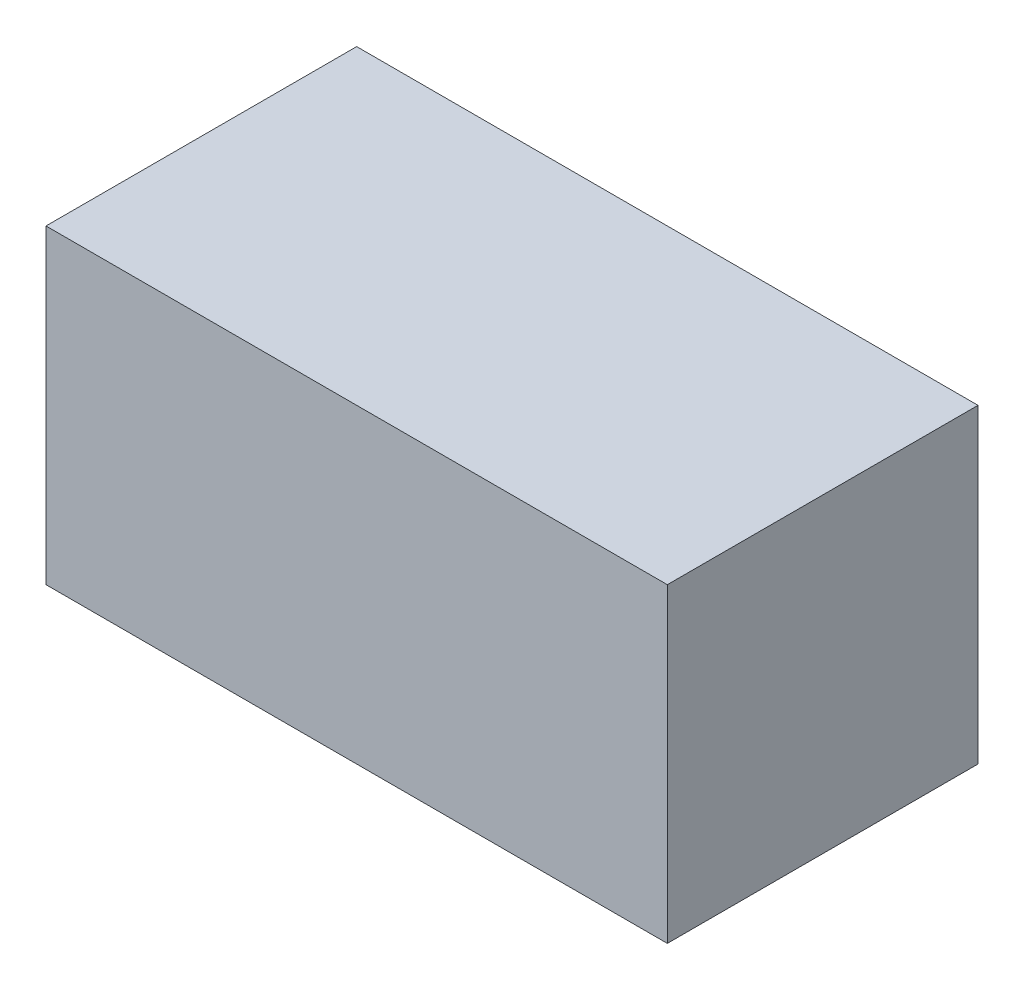
from build123d import *

# Parameters (mm, degrees)
SKETCH1_W           = 40
SKETCH1_H           = 20
BOSS_EXTRUDE1_DEPTH = 10
SKETCH2_R           = 4
CUT_EXTRUDE1_DEPTH  = 5


with BuildPart() as part:
    # Sketch1 → Boss-Extrude1 (new, symmetric)
    with BuildSketch(Plane.XY):
        with Locations((20, 10)):
            Rectangle(SKETCH1_W, SKETCH1_H)
    extrude(amount=BOSS_EXTRUDE1_DEPTH, both=True)

    # Sketch2 → Cut-Extrude1 (cut)
    with BuildSketch(Plane.XY):
        with Locations((20, 10)):
            Circle(SKETCH2_R)
    extrude(amount=CUT_EXTRUDE1_DEPTH, mode=Mode.SUBTRACT)


solid = part.part
